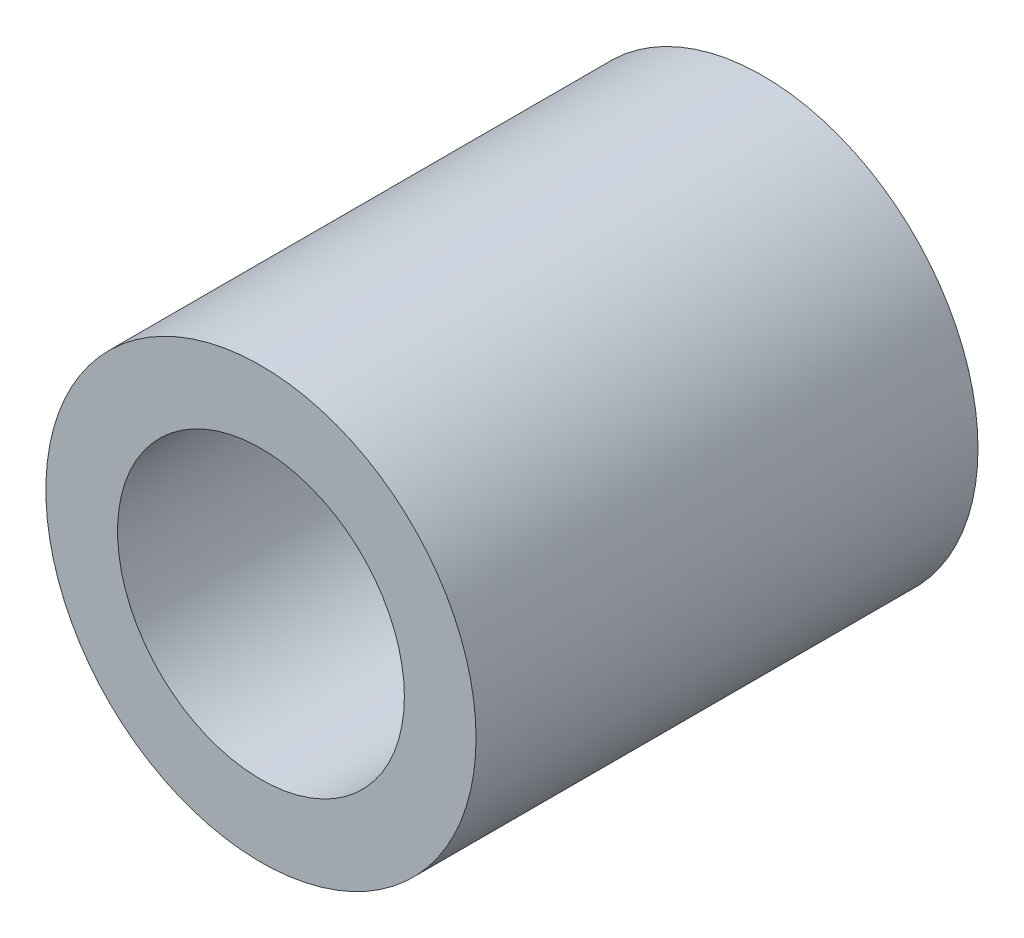
from build123d import *

# Parameters (mm, degrees)
ESQUISSE1_R        = 3
ESQUISSE1_R_2      = 2
EXTRU_MINCE1_DEPTH = 7


with BuildPart() as part:
    # Esquisse1 → Extru.-Mince1 (new body)
    with BuildSketch(Plane.XY):
        Circle(ESQUISSE1_R)
        Circle(ESQUISSE1_R_2, mode=Mode.SUBTRACT)
    extrude(amount=EXTRU_MINCE1_DEPTH)


solid = part.part
